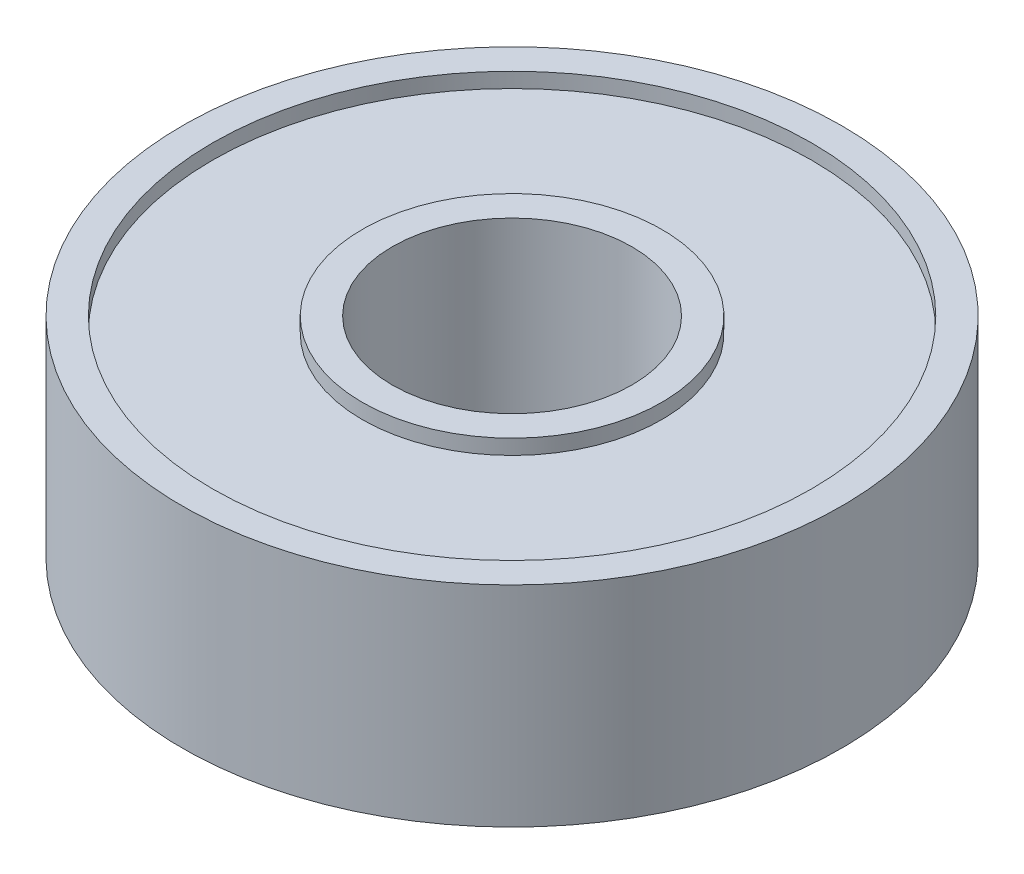
from build123d import *

# Parameters (mm, degrees)
SKETCH1_R           = 11
SKETCH1_R_2         = 4
BOSS_EXTRUDE1_DEPTH = 7
SKETCH2_R           = 10
SKETCH2_R_2         = 5
CUT_EXTRUDE1_DEPTH  = 0.5


with BuildPart() as part:
    # Sketch1 → Boss-Extrude1 (new body)
    with BuildSketch(Plane(origin=(0, 0, 0), x_dir=(1, 0, 0), z_dir=(0, 1, 0))):
        with Locations(Location((0, 0, 0), (0, 0, 90))):
            Circle(SKETCH1_R)
        with Locations(Location((0, 0, 0), (0, 0, 90))):
            Circle(SKETCH1_R_2, mode=Mode.SUBTRACT)
    extrude(amount=BOSS_EXTRUDE1_DEPTH)

    # Sketch2 → Cut-Extrude1 (cut)
    with BuildSketch(Plane(origin=(0, 7, 0), x_dir=(1, 0, 0), z_dir=(0, 1, 0))):
        with Locations(Location((0, 0, 0), (0, 0, 270))):
            Circle(SKETCH2_R)
        with Locations(Location((0, 0, 0), (0, 0, 270))):
            Circle(SKETCH2_R_2, mode=Mode.SUBTRACT)
    cut_extrude1 = extrude(amount=-CUT_EXTRUDE1_DEPTH, mode=Mode.SUBTRACT)

    # Mirror1: Cut-Extrude1 across plane
    add(cut_extrude1.mirror(Plane.ZX.offset(3.5)), mode=Mode.SUBTRACT)


solid = part.part
